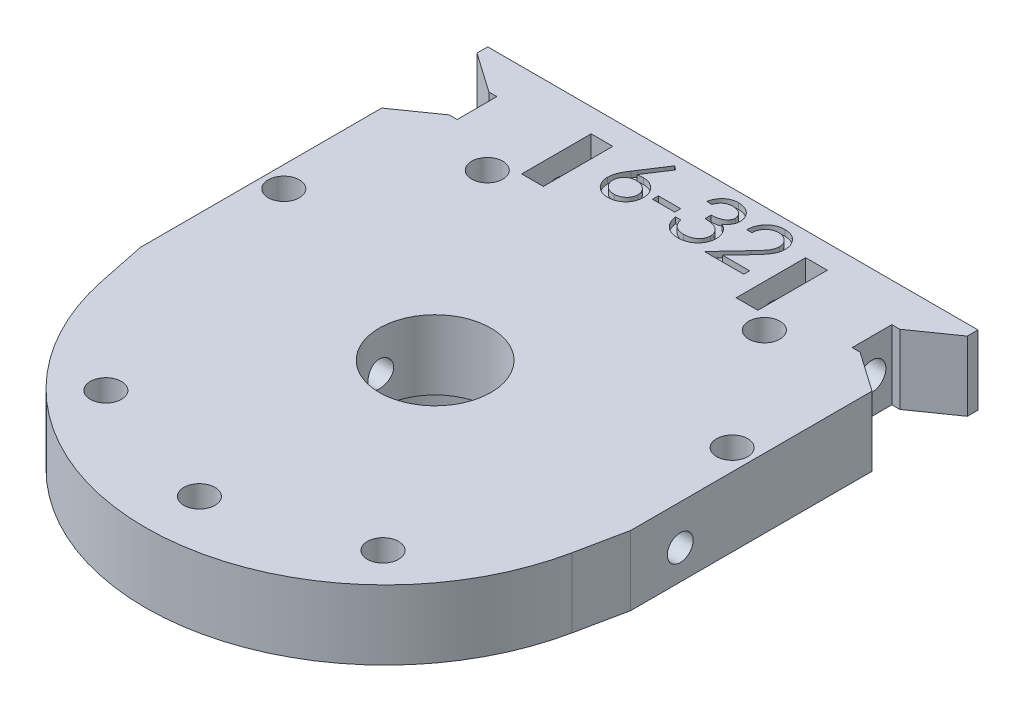
from build123d import *
from OCP.BRepFilletAPI import BRepFilletAPI_MakeChamfer

# Parameters (mm, degrees)
BOSS_EXTRUDE1_DEPTH = 4.445
SKETCH2_R           = 7.14375
CUT_EXTRUDE1_DEPTH  = 82.936009983
SKETCH3_R           = 1.778
CUT_EXTRUDE2_DEPTH  = 25.4
SKETCH7_W           = 6.096
SKETCH7_H           = 5.08
CUT_EXTRUDE12_DEPTH = 82.936009983
CHAMFER3_SIZE       = 5.08
CHAMFER3_SIZE2      = 3.556
CHAMFER4_SIZE       = 3.556
CHAMFER4_SIZE2      = 5.08
SKETCH9_W           = 2.778125
SKETCH9_H           = 8.89
CUT_EXTRUDE14_DEPTH = 8.89
SKETCH10_W          = 2.849358974
SKETCH10_H          = 0.759829059
CUT_EXTRUDE15_DEPTH = 0.762
SKETCH12_R          = 1.9939
CUT_EXTRUDE16_DEPTH = 82.936010113
SKETCH14_R          = 16.51
SKETCH14_R_2        = 12.7
BOSS_EXTRUDE3_DEPTH = 10.16
SKETCH15_R          = 1.651
CUT_EXTRUDE17_DEPTH = 63.5


with BuildPart() as part:
    # Sketch1 → Boss-Extrude1 (new, symmetric)
    with BuildSketch(Plane(origin=(0, 0, 0), x_dir=(1, 0, 0), z_dir=(0, 1, 0))):
        with BuildLine():
            Line((-31.369, 0), (-31.369, -44.45))
            Line((-31.369, -44.45), (-30.083574899, -50.668535383))
            ThreePointArc((-30.083574899, -50.668535383), (0, -75.169564792), (30.083574899, -50.668535383))
            Line((30.083574899, -50.668535383), (31.369, -44.45))
            Line((31.369, -44.45), (31.369, 0))
            Line((31.369, 0), (-31.369, 0))
        make_face()
    extrude(amount=BOSS_EXTRUDE1_DEPTH, both=True)

    # Sketch2 → Cut-Extrude1 (cut, through all)
    with BuildSketch(Plane(origin=(0, 4.445, 0), x_dir=(1, 0, 0), z_dir=(0, 1, 0))):
        with Locations(Location((0, -38.1, 0), (0, 0, 270))):
            Circle(SKETCH2_R)
    extrude(amount=-CUT_EXTRUDE1_DEPTH, mode=Mode.SUBTRACT)

    # Sketch3 → Cut-Extrude2 (cut)
    with BuildSketch(Plane(origin=(31.369, 0, 0), x_dir=(0, 0, -1), z_dir=(1, 0, 0))):
        with Locations((-7.4676, 0)):
            Circle(SKETCH3_R)
    cut_extrude2 = extrude(amount=-CUT_EXTRUDE2_DEPTH, mode=Mode.SUBTRACT)

    # Sketch7 → Cut-Extrude12 (cut, through all)
    with BuildSketch(Plane(origin=(0, 4.445, 0), x_dir=(1, 0, 0), z_dir=(0, 1, 0))):
        with Locations((-28.321, -7.4676)):
            Rectangle(SKETCH7_W, SKETCH7_H)
        with Locations((28.321, -7.4676)):
            Rectangle(SKETCH7_W, SKETCH7_H)
    extrude(amount=-CUT_EXTRUDE12_DEPTH, mode=Mode.SUBTRACT)

    # Mirror1: Cut-Extrude2 across plane
    add(cut_extrude2.mirror(Plane(origin=(0, 0, 0), x_dir=(0, 0, 1), z_dir=(1, 0, 0))), mode=Mode.SUBTRACT)

    # Chamfer3: one chamfer whose edges measure the first distance from different faces: ONE call of the kernel's chamfer builder (chamfer() names one face for all edges)
    chamfer3_edges_1 = [part.edges().sort_by_distance(p)[0] for p in [
        (-31.369, 0, 4.9276),
    ]]
    chamfer3_side_1 = [part.faces().sort_by_distance(p)[0] for p in [
        (-28.321, 0, 4.9276),
    ]]
    chamfer3_edges_2 = [part.edges().sort_by_distance(p)[0] for p in [
        (31.369, 0, 10.0076),
    ]]
    chamfer3_side_2 = [part.faces().sort_by_distance(p)[0] for p in [
        (28.321, 0, 10.0076),
    ]]
    chamfer3 = BRepFilletAPI_MakeChamfer(part.part.solid().wrapped)
    for e in chamfer3_edges_1:
        chamfer3.Add(CHAMFER3_SIZE, CHAMFER3_SIZE2, e.wrapped, chamfer3_side_1[0].wrapped)  # the first distance lies on this face
    for e in chamfer3_edges_2:
        chamfer3.Add(CHAMFER3_SIZE, CHAMFER3_SIZE2, e.wrapped, chamfer3_side_2[0].wrapped)  # the first distance lies on this face
    add(Compound.cast(chamfer3.Shape()), mode=Mode.REPLACE)

    # Chamfer4: one chamfer whose edges measure the first distance from different faces: ONE call of the kernel's chamfer builder (chamfer() names one face for all edges)
    chamfer4_edges_1 = [part.edges().sort_by_distance(p)[0] for p in [
        (-31.369, 0, 10.0076),
    ]]
    chamfer4_side_1 = [part.faces().sort_by_distance(p)[0] for p in [
        (-31.369, 0, 27.2288),
    ]]
    chamfer4_edges_2 = [part.edges().sort_by_distance(p)[0] for p in [
        (31.369, 0, 4.9276),
    ]]
    chamfer4_side_2 = [part.faces().sort_by_distance(p)[0] for p in [
        (31.369, 0, 2.4638),
    ]]
    chamfer4 = BRepFilletAPI_MakeChamfer(part.part.solid().wrapped)
    for e in chamfer4_edges_1:
        chamfer4.Add(CHAMFER4_SIZE, CHAMFER4_SIZE2, e.wrapped, chamfer4_side_1[0].wrapped)  # the first distance lies on this face
    for e in chamfer4_edges_2:
        chamfer4.Add(CHAMFER4_SIZE, CHAMFER4_SIZE2, e.wrapped, chamfer4_side_2[0].wrapped)  # the first distance lies on this face
    add(Compound.cast(chamfer4.Shape()), mode=Mode.REPLACE)

    # Sketch9 → Cut-Extrude14 (cut)
    with BuildSketch(Plane(origin=(0, 4.445, 0), x_dir=(1, 0, 0), z_dir=(0, 1, 0))):
        with Locations((-13.7239375, -7.4676)):
            Rectangle(SKETCH9_W, SKETCH9_H)
        with Locations((13.7239375, -7.4676)):
            Rectangle(SKETCH9_W, SKETCH9_H)
    extrude(amount=-CUT_EXTRUDE14_DEPTH, mode=Mode.SUBTRACT)

    # Sketch10 → Cut-Extrude15 (cut)
    # profile 1 of 4: a face of its own
    with BuildSketch(Plane(origin=(0, 4.445, 0), x_dir=(1, 0, 0), z_dir=(0, 1, 0))):
        with BuildLine():
            Line((-6.220441226, -1.220146954), (-5.708447035, -1.622322101))
            Line((-5.708447035, -1.622322101), (-7.665897289, -4.615633065))
            add(Edge.make_bspline(
                [(-7.665897289, -4.615633065), (-7.535573536, -4.594860393), (-7.28136232, -4.554340948), (-7.024047835, -4.54765663), (-6.898648023, -4.54439909)],
                knots=[0, 0, 0, 0, 1.025318673, 2, 2, 2, 2], degree=3))
            add(Edge.make_bspline(
                [(-6.898648023, -4.54439909), (-6.823352906, -4.54642286), (-6.675136708, -4.550406591), (-6.457528977, -4.581064075), (-6.248425729, -4.629377228), (-6.04869365, -4.699803503), (-5.857615838, -4.78976682), (-5.674095766, -4.897587429), (-5.501583178, -5.028832786), (-5.337856516, -5.175443609), (-5.18920916, -5.337827892), (-5.057603175, -5.510127389), (-4.947056466, -5.692162587), (-4.857364999, -5.883841286), (-4.787716339, -6.084868019), (-4.73694249, -6.294985581), (-4.706929019, -6.514338862), (-4.702853397, -6.663517666), (-4.700783106, -6.739295925)],
                knots=[0, 0, 0, 0, 1.04369286, 2.054478336, 3.041073146, 4.015093852, 4.984733326, 5.965804835, 6.960378782, 7.985147595, 9.009457201, 10.008161701, 10.986880575, 11.956520048, 12.937015923, 13.931873656, 14.949455224, 16, 16, 16, 16], degree=3))
            add(Edge.make_bspline(
                [(-4.700783106, -6.739295925), (-4.703795345, -6.842969632), (-4.709722717, -7.046974952), (-4.768785752, -7.344105647), (-4.860563667, -7.627172805), (-4.991749435, -7.891657017), (-5.154695479, -8.13719579), (-5.353403051, -8.354758358), (-5.580825101, -8.548793271), (-5.837972157, -8.711049781), (-6.114711431, -8.843559572), (-6.405439826, -8.938736002), (-6.707333952, -8.997332678), (-6.912237039, -9.004678787), (-7.015887273, -9.008394817)],
                knots=[0, 0, 0, 0, 1.031375318, 2.029502543, 3.004789286, 3.987476834, 4.960371455, 5.9300674, 6.912260825, 7.929083631, 8.949397511, 9.960523116, 10.96833055, 12, 12, 12, 12], degree=3))
            add(Edge.make_bspline(
                [(-7.015887273, -9.008394817), (-7.115575289, -9.005160115), (-7.313039795, -8.998752736), (-7.603515876, -8.941674834), (-7.88262593, -8.849161467), (-8.148414453, -8.721707911), (-8.394626417, -8.560718725), (-8.614898681, -8.366911901), (-8.808132937, -8.1444302), (-8.968945884, -7.893308131), (-9.096493534, -7.623454388), (-9.192145542, -7.34207074), (-9.24801759, -7.050182446), (-9.255825035, -6.852314034), (-9.259757465, -6.752652296)],
                knots=[0, 0, 0, 0, 1.012016664, 2.004627821, 2.994792927, 3.992885782, 4.990978636, 5.973936114, 6.964471063, 7.975201453, 8.993600317, 9.990122807, 10.98767138, 12, 12, 12, 12], degree=3))
            add(Edge.make_bspline(
                [(-9.259757465, -6.752652296), (-9.25725674, -6.676357928), (-9.252150736, -6.520579406), (-9.216498893, -6.284647214), (-9.159211745, -6.043239091), (-9.095055056, -5.838442714), (-9.027267515, -5.670672493), (-8.970852973, -5.535410104), (-8.900634681, -5.396215832), (-8.825761025, -5.248316636), (-8.739492319, -5.095524137), (-8.645690861, -4.935284703), (-8.541763266, -4.770146757), (-8.468907255, -4.658081543), (-8.431662513, -4.600792653)],
                knots=[0, 0, 0, 0, 1.173818275, 2.396712641, 3.66331629, 4.989737886, 5.693666774, 6.447286557, 7.243889047, 8.091586357, 8.998013824, 9.943181721, 10.948533338, 12, 12, 12, 12], degree=3))
            Line((-8.431662513, -4.600792653), (-6.220441226, -1.220146954))
        make_face()
        with BuildLine():
            add(Edge.make_bspline(
                [(-7.03814789, -5.30422815), (-7.094582974, -5.305875009), (-7.204817089, -5.309091804), (-7.366546117, -5.32777192), (-7.519609166, -5.362948942), (-7.666034099, -5.407751012), (-7.803083403, -5.469352488), (-7.931753114, -5.544180463), (-8.052540808, -5.632278623), (-8.164181325, -5.732398885), (-8.265399613, -5.842016888), (-8.35256634, -5.959427377), (-8.42775542, -6.081800773), (-8.488888603, -6.210159551), (-8.536492597, -6.344454642), (-8.570927061, -6.484068386), (-8.590090835, -6.629937001), (-8.593279025, -6.728854131), (-8.594907037, -6.779365036)],
                knots=[0, 0, 0, 0, 1.129588631, 2.206414736, 3.251139165, 4.268635594, 5.265702196, 6.250456724, 7.242448911, 8.251968645, 9.246821453, 10.222880186, 11.173611482, 12.116736599, 13.062300278, 14.020270554, 14.989073742, 16, 16, 16, 16], degree=3))
            add(Edge.make_bspline(
                [(-8.594907037, -6.779365036), (-8.593581239, -6.82942416), (-8.590981546, -6.92758265), (-8.567375802, -7.072233913), (-8.531318211, -7.211436303), (-8.47768104, -7.344472187), (-8.413700793, -7.473369393), (-8.329234524, -7.593459081), (-8.235642327, -7.712034896), (-8.123768168, -7.819988011), (-8.003703716, -7.920437865), (-7.875431171, -8.008237735), (-7.741742589, -8.083350135), (-7.600833079, -8.142216959), (-7.454701833, -8.190528366), (-7.302131327, -8.224525164), (-7.143015449, -8.24374561), (-7.035230681, -8.246937953), (-6.980270285, -8.248565757)],
                knots=[0, 0, 0, 0, 0.989467248, 1.94019797, 2.891935182, 3.827694429, 4.772920941, 5.730924762, 6.725747692, 7.756678648, 8.79901574, 9.819492441, 10.826891316, 11.826466727, 12.835195252, 13.867842842, 14.912794438, 16, 16, 16, 16], degree=3))
            add(Edge.make_bspline(
                [(-6.980270285, -8.248565757), (-6.92530998, -8.246937826), (-6.817525388, -8.243745232), (-6.65840823, -8.2245266), (-6.505842456, -8.190523095), (-6.359694013, -8.142236065), (-6.218847984, -8.083279258), (-6.085276323, -8.008705028), (-5.958216858, -7.919897912), (-5.838073589, -7.820159672), (-5.726665087, -7.711420469), (-5.63082818, -7.594517556), (-5.548948669, -7.472398811), (-5.482412973, -7.344979944), (-5.429366573, -7.211355862), (-5.393126135, -7.072255463), (-5.36956914, -6.927577008), (-5.366962748, -6.829422255), (-5.365633533, -6.779365036)],
                knots=[0, 0, 0, 0, 1.087397944, 2.132534446, 3.165364764, 4.174271784, 5.174024072, 6.181601208, 7.194203697, 8.236725232, 9.267838612, 10.269026844, 11.221737037, 12.171628256, 13.107553087, 14.05945871, 15.010357665, 16, 16, 16, 16], degree=3))
            add(Edge.make_bspline(
                [(-5.365633533, -6.779365036), (-5.36679832, -6.728788236), (-5.369084418, -6.629522428), (-5.394941509, -6.484133636), (-5.430802867, -6.343745283), (-5.484953615, -6.20923969), (-5.555304302, -6.081147644), (-5.64099418, -5.958822089), (-5.74012312, -5.841325187), (-5.854629579, -5.73218391), (-5.979280574, -5.632389261), (-6.111816897, -5.544294534), (-6.250475441, -5.469946666), (-6.395115619, -5.4079133), (-6.547394721, -5.363146913), (-6.704854272, -5.327897548), (-6.869508169, -5.309139611), (-6.981218657, -5.305886156), (-7.03814789, -5.30422815)],
                knots=[0, 0, 0, 0, 0.978206639, 1.919901502, 2.851605144, 3.780102724, 4.718870031, 5.675451981, 6.667674623, 7.690630536, 8.733308323, 9.756129687, 10.767539656, 11.776269907, 12.797430371, 13.836405707, 14.897401972, 16, 16, 16, 16], degree=3))
        make_face(mode=Mode.SUBTRACT)
    # profile 2 of 4: a face of its own
    with BuildSketch(Plane(origin=(0, 4.445, 0), x_dir=(1, 0, 0), z_dir=(0, 1, 0))):
        with Locations((-2.516274559, -5.969078578)):
            Rectangle(SKETCH10_W, SKETCH10_H)
    # profile 3 of 4: a face of its own
    with BuildSketch(Plane(origin=(0, 4.445, 0), x_dir=(1, 0, 0), z_dir=(0, 1, 0))):
        with BuildLine():
            Line((0.428063048, -3.119719603), (-0.236787379, -3.119719603))
            add(Edge.make_bspline(
                [(-0.236787379, -3.119719603), (-0.218775497, -3.045144179), (-0.18356374, -2.899355324), (-0.110120543, -2.691059955), (-0.03011212, -2.493948501), (0.065961485, -2.311711812), (0.170755015, -2.140687468), (0.290818109, -1.984754488), (0.420611521, -1.839947044), (0.564174331, -1.711437358), (0.714729998, -1.595067831), (0.874399943, -1.49584896), (1.039971735, -1.41049617), (1.212592533, -1.340180012), (1.392776263, -1.28720932), (1.578893965, -1.248777415), (1.771433374, -1.223819557), (1.902132441, -1.221383775), (1.968497744, -1.220146954)],
                knots=[0, 0, 0, 0, 1.162005537, 2.271625781, 3.343758855, 4.383309926, 5.390229558, 6.379919256, 7.361854164, 8.333198761, 9.295911338, 10.242430842, 11.177959212, 12.116337295, 13.062827104, 14.020064771, 14.994644689, 16, 16, 16, 16], degree=3))
            add(Edge.make_bspline(
                [(1.968497744, -1.220146954), (2.065192881, -1.223066324), (2.256473954, -1.228841386), (2.53748907, -1.281576943), (2.808479171, -1.365026806), (3.066478078, -1.480329529), (3.306123761, -1.622542675), (3.519348689, -1.791801368), (3.703262704, -1.98483989), (3.857555803, -2.198057151), (3.978364551, -2.425927979), (4.067447375, -2.660454978), (4.121679933, -2.901081818), (4.128708445, -3.063551392), (4.132229715, -3.144948302)],
                knots=[0, 0, 0, 0, 1.083050992, 2.142477498, 3.193116406, 4.255571735, 5.30263384, 6.308962982, 7.297363603, 8.282367274, 9.249857812, 10.179914175, 11.08814088, 12, 12, 12, 12], degree=3))
            add(Edge.make_bspline(
                [(4.132229715, -3.144948302), (4.12976678, -3.223279351), (4.1249472, -3.376561058), (4.08402419, -3.600338227), (4.015155767, -3.811246281), (3.919758103, -4.010173074), (3.796268488, -4.195857319), (3.646677946, -4.368716788), (3.469930645, -4.529518172), (3.335990227, -4.62163439), (3.267033734, -4.669058546)],
                knots=[0, 0, 0, 0, 1.024540389, 2.004866551, 2.965041327, 3.920577974, 4.882998113, 5.874504559, 6.905732034, 8, 8, 8, 8], degree=3))
            add(Edge.make_bspline(
                [(3.267033734, -4.669058546), (3.345840948, -4.707112342), (3.501980832, -4.782507919), (3.714812786, -4.930369272), (3.908017622, -5.101091874), (4.015763828, -5.23432049), (4.069899987, -5.301260068)],
                knots=[0, 0, 0, 0, 1.015518401, 2.012035669, 3.001164323, 4, 4, 4, 4], degree=3))
            add(Edge.make_bspline(
                [(4.069899987, -5.301260068), (4.105547495, -5.350065642), (4.176258758, -5.446877566), (4.263540638, -5.602529667), (4.342723263, -5.759906986), (4.404424561, -5.923227729), (4.452205913, -6.090598941), (4.486360514, -6.262308013), (4.507578279, -6.43849516), (4.510616864, -6.55768991), (4.512144245, -6.617604552)],
                knots=[0, 0, 0, 0, 1.025084078, 2.033381695, 3.024893161, 4.013698104, 4.991890475, 5.976764909, 6.982997093, 8, 8, 8, 8], degree=3))
            add(Edge.make_bspline(
                [(4.512144245, -6.617604552), (4.508345858, -6.721341796), (4.500766959, -6.928328093), (4.433025002, -7.23413292), (4.328010309, -7.533060233), (4.178876461, -7.818968643), (3.997123567, -8.086473783), (3.780890565, -8.325818637), (3.532634333, -8.531555683), (3.255762377, -8.703450666), (2.955794455, -8.840860268), (2.634959452, -8.936231855), (2.297880171, -8.998347554), (2.066724724, -9.005008427), (1.949205209, -9.008394817)],
                knots=[0, 0, 0, 0, 0.955779014, 1.907060117, 2.875433937, 3.871313158, 4.872415639, 5.851225146, 6.836215519, 7.83643374, 8.849228613, 9.86973379, 10.916971861, 12, 12, 12, 12], degree=3))
            add(Edge.make_bspline(
                [(1.949205209, -9.008394817), (1.870001023, -9.006557099), (1.714153597, -9.002941082), (1.485038193, -8.978221377), (1.266340596, -8.933072866), (1.057765113, -8.872317536), (0.859126453, -8.795288348), (0.671030764, -8.699363771), (0.492320822, -8.586521092), (0.324683043, -8.455428331), (0.168137408, -8.308782828), (0.026844141, -8.143981257), (-0.10155242, -7.964070086), (-0.213614339, -7.766959617), (-0.314445889, -7.555197155), (-0.397378914, -7.326071167), (-0.470373367, -7.081629987), (-0.504310867, -6.911285437), (-0.521723277, -6.82388627)],
                knots=[0, 0, 0, 0, 1.048658725, 2.063410685, 3.046034179, 4.001477787, 4.936774919, 5.862367409, 6.792675028, 7.730719943, 8.675894397, 9.627829632, 10.600096036, 11.597688215, 12.626045268, 13.701542398, 14.82072376, 16, 16, 16, 16], degree=3))
            Line((-0.521723277, -6.82388627), (0.143127151, -6.82388627))
            add(Edge.make_bspline(
                [(0.143127151, -6.82388627), (0.160448451, -6.880928348), (0.194139884, -6.991880145), (0.251489482, -7.151562125), (0.316827324, -7.297946671), (0.386919807, -7.432107612), (0.460534184, -7.555366198), (0.542904109, -7.664463154), (0.6279288, -7.764190332), (0.692020098, -7.820376427), (0.723387233, -7.847874651)],
                knots=[0, 0, 0, 0, 1.198163088, 2.33053128, 3.407730985, 4.417276592, 5.372219308, 6.28897303, 7.162600585, 8, 8, 8, 8], degree=3))
            add(Edge.make_bspline(
                [(0.723387233, -7.847874651), (0.764866654, -7.879853958), (0.847697457, -7.943713859), (0.982673546, -8.025208972), (1.124627555, -8.095823143), (1.276635282, -8.149763632), (1.435416546, -8.195436347), (1.603537802, -8.225324779), (1.779515812, -8.245831409), (1.899674245, -8.247641014), (1.961077538, -8.248565757)],
                knots=[0, 0, 0, 0, 0.946170439, 1.889420265, 2.845303464, 3.807233317, 4.801018734, 5.828864929, 6.890507805, 8, 8, 8, 8], degree=3))
            add(Edge.make_bspline(
                [(1.961077538, -8.248565757), (2.030405785, -8.247262091), (2.165971188, -8.244712884), (2.363783973, -8.221269305), (2.551971404, -8.187126596), (2.728444097, -8.134394116), (2.895513671, -8.069241314), (3.050838163, -7.987435522), (3.196456587, -7.891455862), (3.330503829, -7.782364643), (3.451038486, -7.662939145), (3.557167123, -7.538028144), (3.647389323, -7.408158305), (3.720167897, -7.272610949), (3.777636561, -7.131947381), (3.816759336, -6.985772859), (3.84396171, -6.835283646), (3.846177039, -6.732987328), (3.847293817, -6.681418321)],
                knots=[0, 0, 0, 0, 1.217147791, 2.380027433, 3.494444702, 4.572153297, 5.609568379, 6.639424714, 7.649109417, 8.668170816, 9.669597737, 10.625200337, 11.543417969, 12.441394052, 13.322311151, 14.205496177, 15.095365482, 16, 16, 16, 16], degree=3))
            add(Edge.make_bspline(
                [(3.847293817, -6.681418321), (3.844054679, -6.612390987), (3.83759252, -6.47467979), (3.788256027, -6.272077591), (3.707105431, -6.076871368), (3.593498615, -5.892391612), (3.455204656, -5.721415954), (3.293565604, -5.568864649), (3.107239187, -5.44298629), (2.935747131, -5.356015301), (2.783844216, -5.296670158), (2.653848319, -5.257141483), (2.508313509, -5.223669246), (2.348999737, -5.192528271), (2.174706595, -5.166024751), (1.985623835, -5.143922907), (1.78171314, -5.126238071), (1.640550172, -5.118340586), (1.567806638, -5.114270885)],
                knots=[0, 0, 0, 0, 1.07054697, 2.135767047, 3.216561865, 4.33974944, 5.486079747, 6.621378074, 7.775625952, 8.963672916, 9.598146892, 10.304877434, 11.070270905, 11.915000392, 12.823868403, 13.805723172, 14.86925407, 16, 16, 16, 16], degree=3))
            Line((1.567806638, -5.114270885), (1.567806638, -4.354441825))
            add(Edge.make_bspline(
                [(1.567806638, -4.354441825), (1.659460772, -4.352886491), (1.838988705, -4.349839973), (2.10123165, -4.312993017), (2.352000161, -4.262022355), (2.585736765, -4.183948698), (2.798776542, -4.093270069), (2.983603033, -3.987749559), (3.137626828, -3.870455007), (3.260099429, -3.739575983), (3.352236296, -3.599209133), (3.419603018, -3.452912207), (3.459397042, -3.299402945), (3.46470917, -3.194639231), (3.467379287, -3.14198022)],
                knots=[0, 0, 0, 0, 1.321986639, 2.589447074, 3.816329219, 5.01088745, 6.139805852, 7.153945165, 8.075214402, 8.924034688, 9.728124013, 10.488707548, 11.240355623, 12, 12, 12, 12], degree=3))
            add(Edge.make_bspline(
                [(3.467379287, -3.14198022), (3.466502117, -3.103292326), (3.46475703, -3.026324596), (3.442749458, -2.913876534), (3.409678572, -2.804866199), (3.364213145, -2.699757167), (3.303358557, -2.599278421), (3.230532552, -2.50257332), (3.14381674, -2.410193988), (3.044448877, -2.324087312), (2.93774389, -2.24202576), (2.820798533, -2.172358561), (2.697138898, -2.112784847), (2.566628079, -2.063658067), (2.42884254, -2.026702574), (2.284429659, -2.000168376), (2.133114062, -1.983578674), (2.029880563, -1.981190193), (1.97740199, -1.979976013)],
                knots=[0, 0, 0, 0, 0.884392785, 1.759457502, 2.611959086, 3.489218968, 4.37281399, 5.2945488, 6.255912374, 7.266815255, 8.301784654, 9.332968512, 10.37626691, 11.440494194, 12.520033166, 13.637162961, 14.798855837, 16, 16, 16, 16], degree=3))
            add(Edge.make_bspline(
                [(1.97740199, -1.979976013), (1.893049293, -1.982921063), (1.728288856, -1.98867343), (1.490767282, -2.039056475), (1.269958025, -2.119443418), (1.101177848, -2.215398309), (0.976543066, -2.310120061), (0.887480213, -2.392844446), (0.800018466, -2.484777256), (0.719911783, -2.591580817), (0.638898533, -2.706022189), (0.565144211, -2.833918982), (0.493474529, -2.97193495), (0.450289132, -3.069504043), (0.428063048, -3.119719603)],
                knots=[0, 0, 0, 0, 1.472543308, 2.876219568, 4.221790263, 5.565193594, 6.249813518, 6.953379497, 7.687249741, 8.463570142, 9.283606569, 10.136032583, 11.040678096, 12, 12, 12, 12], degree=3))
        make_face()
    # profile 4 of 4: a face of its own
    with BuildSketch(Plane(origin=(0, 4.445, 0), x_dir=(1, 0, 0), z_dir=(0, 1, 0))):
        with BuildLine():
            Line((6.126780997, -3.689591398), (5.461930569, -3.689591398))
            add(Edge.make_bspline(
                [(5.461930569, -3.689591398), (5.46626371, -3.601388019), (5.474773883, -3.42815893), (5.514627095, -3.175589995), (5.571651952, -2.934174004), (5.652278863, -2.705849353), (5.752410484, -2.488597211), (5.872489042, -2.283280511), (6.014716025, -2.090682495), (6.176020279, -1.91258861), (6.351213898, -1.749208252), (6.540244804, -1.608121321), (6.738883445, -1.488915583), (6.946527173, -1.389260288), (7.165518699, -1.314457614), (7.393870748, -1.258955144), (7.632586587, -1.225561879), (7.7952313, -1.221972466), (7.877949533, -1.220146954)],
                knots=[0, 0, 0, 0, 1.10065271, 2.161652631, 3.183658789, 4.190468796, 5.17591951, 6.163126047, 7.15150782, 8.156236427, 9.156009102, 10.134482811, 11.092018607, 12.041330605, 13.001268258, 13.972401359, 14.968799086, 16, 16, 16, 16], degree=3))
            add(Edge.make_bspline(
                [(7.877949533, -1.220146954), (7.959183123, -1.222048686), (8.118804226, -1.225785523), (8.351768823, -1.257876369), (8.57354743, -1.308137871), (8.783706536, -1.378655502), (8.980569372, -1.473449207), (9.165614817, -1.587320664), (9.341045866, -1.719019307), (9.498963558, -1.874073212), (9.643972326, -2.039601592), (9.769072099, -2.216317655), (9.876203295, -2.39883631), (9.965500551, -2.588549336), (10.031236045, -2.787243013), (10.081143252, -2.992024593), (10.109352944, -3.205013776), (10.113682424, -3.349172652), (10.115883561, -3.422463994)],
                knots=[0, 0, 0, 0, 1.111607364, 2.184268762, 3.212621178, 4.221274766, 5.211760367, 6.196651075, 7.1921475, 8.207485113, 9.220403448, 10.201281604, 11.166441695, 12.114753415, 13.065576456, 14.026450734, 14.996634279, 16, 16, 16, 16], degree=3))
            add(Edge.make_bspline(
                [(10.115883561, -3.422463994), (10.112299488, -3.525646911), (10.105194237, -3.73020203), (10.044415473, -4.030800156), (9.949490358, -4.32203956), (9.835195953, -4.556433516), (9.719895946, -4.745311077), (9.615994055, -4.900819836), (9.494360205, -5.068259744), (9.353224051, -5.247070108), (9.195505138, -5.438651524), (9.019774893, -5.642888258), (8.824780189, -5.857670171), (8.687919696, -6.004367027), (8.617002017, -6.080381663)],
                knots=[0, 0, 0, 0, 1.184426356, 2.348067706, 3.509069118, 4.696110526, 5.333549288, 6.050745305, 6.844228056, 7.710549037, 8.667450064, 9.695053472, 10.805634456, 12, 12, 12, 12], degree=3))
            Line((8.617002017, -6.080381663), (6.763434643, -8.058608492))
            Line((6.763434643, -8.058608492), (10.210862193, -8.058608492))
            Line((10.210862193, -8.058608492), (10.210862193, -8.818437552))
            Line((10.210862193, -8.818437552), (5.176994672, -8.818437552))
            Line((5.176994672, -8.818437552), (8.050098304, -5.752408572))
            add(Edge.make_bspline(
                [(8.050098304, -5.752408572), (8.120049665, -5.679387157), (8.254411912, -5.539127962), (8.4444517, -5.334355363), (8.615137558, -5.144385502), (8.767574373, -4.969577307), (8.898455293, -4.807373822), (9.014601517, -4.663028366), (9.107662018, -4.530198113), (9.208659606, -4.37623048), (9.306479199, -4.188244409), (9.39053702, -3.958514767), (9.441791782, -3.722025415), (9.447940351, -3.56221277), (9.451033133, -3.48182564)],
                knots=[0, 0, 0, 0, 1.329631726, 2.553950428, 3.673215718, 4.687767853, 5.603093632, 6.413772471, 7.123043292, 7.734684054, 8.834405432, 9.900288307, 10.943827018, 12, 12, 12, 12], degree=3))
            add(Edge.make_bspline(
                [(9.451033133, -3.48182564), (9.449687479, -3.43127668), (9.447035452, -3.331654386), (9.423629993, -3.185592196), (9.388259421, -3.044696674), (9.337575292, -2.90853443), (9.270674359, -2.778474466), (9.189239038, -2.654358467), (9.09528007, -2.534366824), (8.98658655, -2.421859009), (8.867182167, -2.318817125), (8.741041005, -2.22753781), (8.607584951, -2.151255026), (8.467376692, -2.08872129), (8.320807115, -2.039666733), (8.167592738, -2.005676074), (8.008156904, -1.984334816), (7.899289338, -1.981447319), (7.843816587, -1.979976013)],
                knots=[0, 0, 0, 0, 0.991446411, 1.95395049, 2.89581595, 3.838931463, 4.798493298, 5.75982156, 6.748411868, 7.785213223, 8.824556874, 9.840280684, 10.836137867, 11.835679398, 12.848801643, 13.863922112, 14.911575587, 16, 16, 16, 16], degree=3))
            add(Edge.make_bspline(
                [(7.843816587, -1.979976013), (7.785881658, -1.981489498), (7.672107022, -1.984461733), (7.505061736, -2.005253038), (7.34570684, -2.041121734), (7.193641479, -2.090179028), (7.048608356, -2.152532956), (6.911312796, -2.230197149), (6.782063013, -2.32287221), (6.660616039, -2.427944721), (6.548720617, -2.54492781), (6.450408063, -2.675335565), (6.364505233, -2.816786928), (6.289555689, -2.968900226), (6.228689478, -3.133055727), (6.182179643, -3.308670703), (6.145377484, -3.494982627), (6.133082782, -3.62364439), (6.126780997, -3.689591398)],
                knots=[0, 0, 0, 0, 1.031018746, 2.02475058, 2.990194455, 3.934040569, 4.864654155, 5.795059489, 6.735614925, 7.690564532, 8.649604399, 9.611025574, 10.590972636, 11.591080095, 12.624614302, 13.701020113, 14.821632451, 16, 16, 16, 16], degree=3))
        make_face()
    extrude(amount=-CUT_EXTRUDE15_DEPTH, mode=Mode.SUBTRACT)

    # Sketch12 → Cut-Extrude16 (cut, through all)
    with BuildSketch(Plane(origin=(0, 4.445, 0), x_dir=(1, 0, 0), z_dir=(0, 1, 0))):
        with Locations(Location((-17.729072672, -62.501975093, 0), (0, 0, 270))):
            Circle(SKETCH12_R)
        with Locations(Location((0, -68.2625, 0), (0, 0, 270))):
            Circle(SKETCH12_R)
        with Locations(Location((-28.686242173, -28.779274907, 0), (0, 0, 270))):
            Circle(SKETCH12_R)
        with Locations(Location((-17.729072672, -13.698024907, 0), (0, 0, 270))):
            Circle(SKETCH12_R)
        with Locations(Location((17.729072672, -13.698024907, 0), (0, 0, 270))):
            Circle(SKETCH12_R)
        with Locations(Location((28.686242173, -28.779274907, 0), (0, 0, 270))):
            Circle(SKETCH12_R)
        with Locations(Location((17.729072672, -62.501975093, 0), (0, 0, 270))):
            Circle(SKETCH12_R)
    extrude(amount=-CUT_EXTRUDE16_DEPTH, mode=Mode.SUBTRACT)

    # Sketch14 → Boss-Extrude3 (add)
    with BuildSketch(Plane.XZ.offset(4.445)):
        with Locations(Location((0, 38.1, 0), (0, 0, 90))):
            Circle(SKETCH14_R)
        with Locations(Location((0, 38.1, 0), (0, 0, 270))):
            Circle(SKETCH14_R_2, mode=Mode.SUBTRACT)
    extrude(amount=BOSS_EXTRUDE3_DEPTH)

    # Sketch15 → Cut-Extrude17 (cut, symmetric)
    with BuildSketch(Plane(origin=(0, 0, 0), x_dir=(0, 0, -1), z_dir=(1, 0, 0))):
        with Locations((-38.1, -0.635)):
            Circle(SKETCH15_R)
    extrude(amount=CUT_EXTRUDE17_DEPTH, both=True, mode=Mode.SUBTRACT)


solid = part.part
